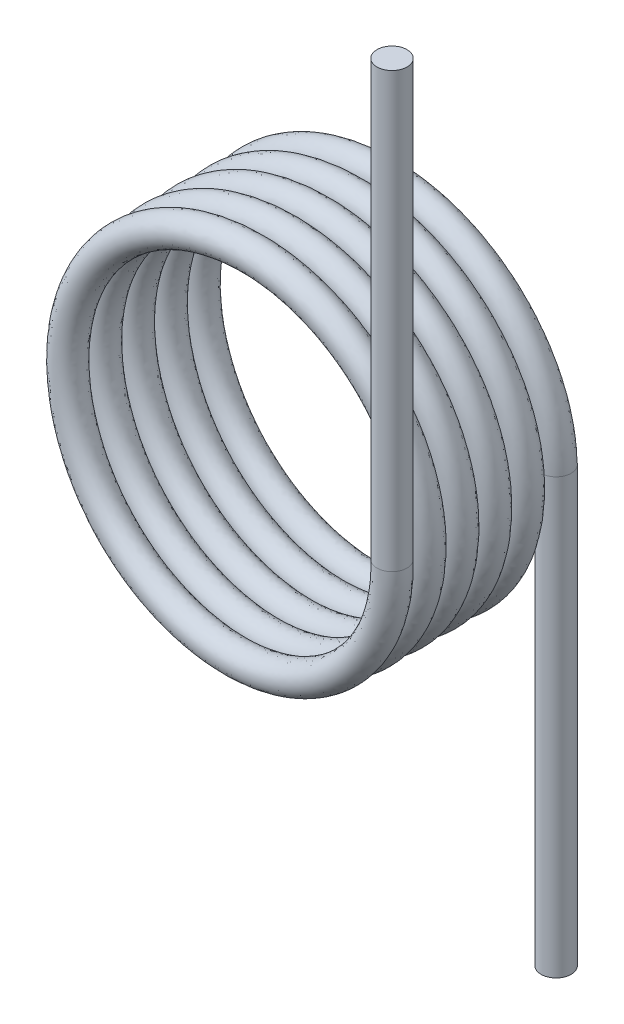
from build123d import *

# Parameters (mm, degrees)
SWEEP1_PITCH        = 0.491666667
SWEEP1_HEIGHT       = 2.458333333
SWEEP1_RADIUS       = 2.55
SWEEP1_START_ANGLE  = 180
SKETCH2_R           = 0.225
SKETCH4_R           = 0.225
BOSS_EXTRUDE1_DEPTH = 6.5
SKETCH5_R           = 0.225
BOSS_EXTRUDE2_DEPTH = 6.5


with BuildPart() as part:
    # Sweep1: sweep along a helix
    with BuildLine() as sweep1_path:
        add(Helix(SWEEP1_PITCH, SWEEP1_HEIGHT, SWEEP1_RADIUS, center=(0, 0, 0), direction=(0, 0, -1), mode=Mode.PRIVATE).rotate(Axis((0, 0, 0), (0, 0, -1)), SWEEP1_START_ANGLE))
    # Sketch2 → Sweep1 (sweep)
    with BuildSketch(Plane(origin=(0, 0, 0), x_dir=(1, 0, 0), z_dir=(0, 1, 0))):
        with Locations((2.55, 0)):
            Circle(SKETCH2_R)
    sweep(path=sweep1_path.line, is_frenet=True)

    # Sketch4 → Boss-Extrude1 (add)
    with BuildSketch(Plane.XZ):
        with Locations(Location((2.55, -2.458333333, 0), (0, 0, 90))):
            Circle(SKETCH4_R)
    extrude(amount=BOSS_EXTRUDE1_DEPTH)

    # Sketch5 → Boss-Extrude2 (add)
    with BuildSketch(Plane(origin=(0, 0, 0), x_dir=(1, 0, 0), z_dir=(0, 1, 0))):
        with Locations(Location((2.55, 0, 0), (0, 0, 270))):
            Circle(SKETCH5_R)
    extrude(amount=BOSS_EXTRUDE2_DEPTH)


solid = part.part
